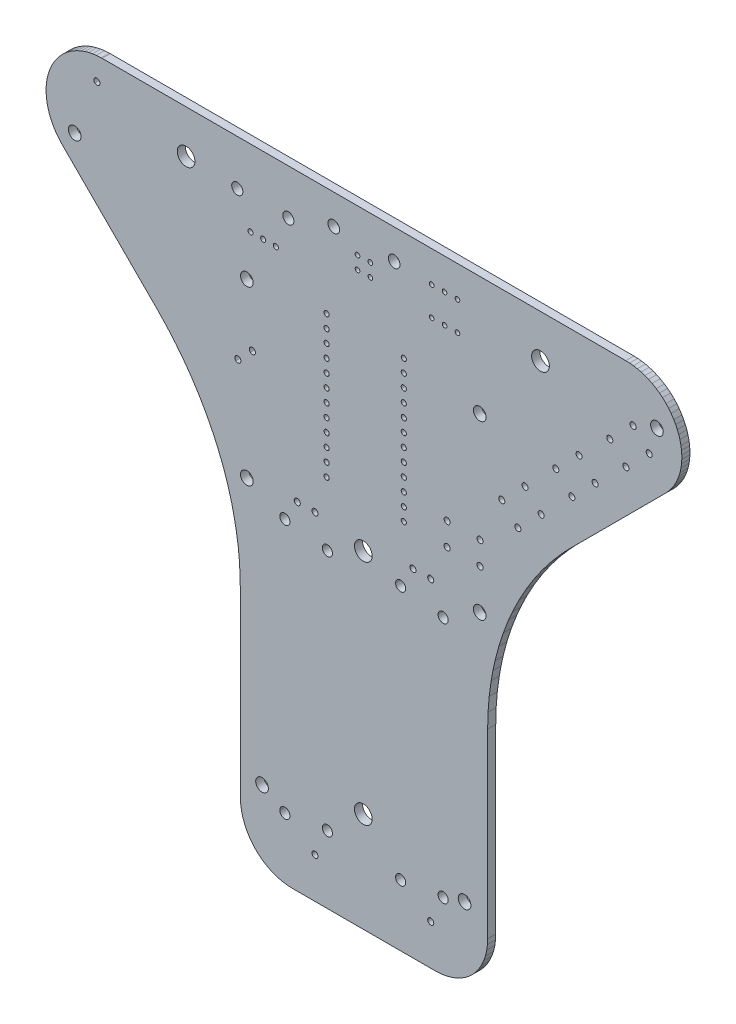
from build123d import *

# Parameters (mm, degrees)
MODEL_R             = 0.599948
MODEL_R_2           = 0.459994
MODEL_R_3           = 1.1500104
MODEL_R_4           = 1.0999978
MODEL_R_5           = 0.499999
MODEL_R_6           = 0.4572
MODEL_R_7           = 1.7500092
MODEL_R_8           = 1.2500102
BOSS_EXTRUDE1_DEPTH = 1.6


with BuildPart() as part:
    # Model → Boss-Extrude1 (new body)
    with BuildSketch(Plane.XY):
        Polygon((-24.3003324, -33.1691996), (-24.4348, -29.3327836), (-24.7142, -26.4668), (-25.1714, -23.5966), (-25.5524, -21.717), (-25.9842, -19.812), (-26.7716, -17.018), (-27.7114, -14.2748), (-28.8036, -11.557), (-29.6164, -9.779), (-30.9372, -7.1628), (-32.4104, -4.5974), (-33.9852, -2.1336), (-35.1282, -0.5334), (-36.9316, 1.8034), (-38.862, 4.064), (-40.894, 6.1976), (-40.9057094, 6.2061852), (-59.437524, 24.7379998), (-59.962161, 25.300559), (-60.4460818, 25.8980432), (-60.8868734, 26.527506), (-61.37402, 27.354657), (-61.7103414, 28.0447242), (-61.9974376, 28.756356), (-62.2338862, 29.486098), (-62.4565172, 30.4183542), (-62.5752114, 31.1758076), (-62.6404894, 31.939611), (-62.6519956, 32.7060814), (-62.6096792, 33.471485), (-62.5137434, 34.2321134), (-62.3646962, 34.9842582), (-62.1047526, 35.9069386), (-61.8391448, 36.6267492), (-61.4371898, 37.4978422), (-61.0615746, 38.1676402), (-60.6398584, 38.8098538), (-60.1740986, 39.4213588), (-59.6665558, 39.9991834), (-59.1196938, 40.5405336), (-58.5361796, 41.0427678), (-57.9188326, 41.5034476), (-57.104153, 42.0174928), (-56.4218836, 42.3768266), (-55.716043, 42.6881544), (-54.9900856, 42.9499014), (-54.2475166, 43.1608738), (-53.4919428, 43.3200048), (-52.7270472, 43.426507), (-51.7634474, 43.4849016), (-51.5703058, 43.486578), (51.8310368, 43.486578), (52.6029682, 43.4598572), (53.3711404, 43.3798726), (54.131845, 43.2469544), (54.8813736, 43.0618138), (55.616094, 42.8253144), (56.3324248, 42.5385992), (57.0268862, 42.2030652), (57.8591172, 41.7174934), (58.492263, 41.2784544), (59.0930492, 40.7966926), (59.79414, 40.1380452), (60.3117412, 39.5690852), (60.788169, 38.9657336), (61.3222802, 38.1676402), (61.6978954, 37.4978422), (62.0256062, 36.8036856), (62.3038124, 36.0885994), (62.5311678, 35.3559872), (62.7421656, 34.4210894), (62.8514364, 33.662239), (62.907164, 32.8976736), (62.9091198, 32.131127), (62.8572784, 31.3663076), (62.7518938, 30.6069238), (62.5456712, 29.6709592), (62.322075, 28.9372294), (62.047501, 28.2207462), (61.7233462, 27.524964), (61.35116, 26.8532864), (60.9327204, 26.2089646), (60.3477838, 25.4467868), (59.8330782, 24.8752106), (59.6982296, 24.7379998), (40.4734268, 5.5013352), (39.1247376, 4.0578786), (37.198046, 1.8116296), (35.391725, -0.5263388), (33.7108038, -2.9494988), (32.1599306, -5.4511194), (30.7434234, -8.024241), (29.4652446, -10.6616754), (28.6917384, -12.4521214), (27.6518116, -15.1804116), (26.758773, -17.9531518), (26.0151626, -20.7626204), (25.603454, -22.6521264), (25.2595634, -24.5521734), (24.8718578, -27.4167854), (24.6388128, -30.291786), (24.561038, -33.1691996), (24.561038, -69.0428642), (24.5178072, -70.0542414), (24.3883688, -71.0500484), (24.1207036, -72.213851), (23.8060484, -73.1490536), (23.3220768, -74.2191302), (22.8337364, -75.0594638), (22.27199, -75.846178), (21.6411302, -76.57338), (20.9459576, -77.2354818), (20.1917046, -77.8274796), (19.3841624, -78.3448776), (18.3533796, -78.8617676), (17.4506128, -79.2020514), (16.5153594, -79.4572706), (15.5547314, -79.6254948), (14.3787368, -79.7108134), (14.1810994, -79.7125914), (-13.9203684, -79.7125914), (-14.9042882, -79.6681414), (-15.8730442, -79.5350962), (-16.8193212, -79.3144718), (-17.9150518, -78.9365198), (-18.786856, -78.5300436), (-19.7735698, -77.9370552), (-20.5389226, -77.359637), (-21.2463634, -76.711175), (-22.0112844, -75.846178), (-22.5730054, -75.0594638), (-23.0613712, -74.2191302), (-23.4726226, -73.3316288), (-23.8036354, -72.4036652), (-24.0519458, -71.4423006), (-24.238077, -70.254876), (-24.2986052, -69.2460134), (-24.3003324, -69.0428642), align=None)
        with Locations((23.06193, -6.059932)):
            Circle(MODEL_R, mode=Mode.SUBTRACT)
        with Locations((16.56207, -6.059932)):
            Circle(MODEL_R, mode=Mode.SUBTRACT)
        with Locations((16.56207, -1.560068)):
            Circle(MODEL_R, mode=Mode.SUBTRACT)
        with Locations((23.06193, -1.560068)):
            Circle(MODEL_R, mode=Mode.SUBTRACT)
        with Locations((-1.143, 35.052)):
            Circle(MODEL_R_2, mode=Mode.SUBTRACT)
        with Locations((-1.143, 32.512)):
            Circle(MODEL_R_2, mode=Mode.SUBTRACT)
        with Locations((1.397, 35.052)):
            Circle(MODEL_R_2, mode=Mode.SUBTRACT)
        with Locations((6.096, 37.592)):
            Circle(MODEL_R_3, mode=Mode.SUBTRACT)
        with Locations((-5.842, 37.592)):
            Circle(MODEL_R_3, mode=Mode.SUBTRACT)
        with Locations((-14.81201, 34.544)):
            Circle(MODEL_R_4, mode=Mode.SUBTRACT)
        with Locations((-22.27072, 28.4481016)):
            Circle(MODEL_R_5, mode=Mode.SUBTRACT)
        with Locations((-19.77136, 28.4481016)):
            Circle(MODEL_R_5, mode=Mode.SUBTRACT)
        with Locations((-17.272, 28.4481016)):
            Circle(MODEL_R_5, mode=Mode.SUBTRACT)
        with Locations((-24.892, 34.544)):
            Circle(MODEL_R_4, mode=Mode.SUBTRACT)
        with Locations((16.0518094, 37.3440198)):
            Circle(MODEL_R_6, mode=Mode.SUBTRACT)
        with Locations((18.6019694, 37.3440198)):
            Circle(MODEL_R_6, mode=Mode.SUBTRACT)
        with Locations((18.6022996, 31.6440312)):
            Circle(MODEL_R_6, mode=Mode.SUBTRACT)
        with Locations((16.0521396, 31.6440312)):
            Circle(MODEL_R_6, mode=Mode.SUBTRACT)
        with Locations((13.5019796, 31.6440312)):
            Circle(MODEL_R_6, mode=Mode.SUBTRACT)
        with Locations((30.5348894, 4.239006)):
            Circle(MODEL_R, mode=Mode.SUBTRACT)
        with Locations((35.130994, 8.8351106)):
            Circle(MODEL_R, mode=Mode.SUBTRACT)
        with Locations((31.9491106, 12.016994)):
            Circle(MODEL_R, mode=Mode.SUBTRACT)
        with Locations((27.353006, 7.4208894)):
            Circle(MODEL_R, mode=Mode.SUBTRACT)
        with Locations((41.2028894, 14.907006)):
            Circle(MODEL_R, mode=Mode.SUBTRACT)
        with Locations((45.798994, 19.5031106)):
            Circle(MODEL_R, mode=Mode.SUBTRACT)
        with Locations((42.6171106, 22.684994)):
            Circle(MODEL_R, mode=Mode.SUBTRACT)
        with Locations((38.021006, 18.0888894)):
            Circle(MODEL_R, mode=Mode.SUBTRACT)
        with Locations((51.8708894, 25.321006)):
            Circle(MODEL_R, mode=Mode.SUBTRACT)
        with Locations((56.466994, 29.9171106)):
            Circle(MODEL_R, mode=Mode.SUBTRACT)
        with Locations((53.2851106, 33.098994)):
            Circle(MODEL_R, mode=Mode.SUBTRACT)
        with Locations((48.689006, 28.5028894)):
            Circle(MODEL_R, mode=Mode.SUBTRACT)
        with Locations((1.397, 32.512)):
            Circle(MODEL_R_2, mode=Mode.SUBTRACT)
        with Locations((13.5018018, 37.3438674)):
            Circle(MODEL_R_6, mode=Mode.SUBTRACT)
        with Locations((0, -60.000134)):
            Circle(MODEL_R_7, mode=Mode.SUBTRACT)
        with Locations((0, -14.99997)):
            Circle(MODEL_R_7, mode=Mode.SUBTRACT)
        with Locations((-34.99993, 34.99993)):
            Circle(MODEL_R_7, mode=Mode.SUBTRACT)
        with Locations((34.99993, 34.99993)):
            Circle(MODEL_R_7, mode=Mode.SUBTRACT)
        with Locations((19.99996, -65.000124)):
            Circle(MODEL_R_8, mode=Mode.SUBTRACT)
        with Locations((-19.99996, -65.000124)):
            Circle(MODEL_R_8, mode=Mode.SUBTRACT)
        with Locations((22.999954, -13.999972)):
            Circle(MODEL_R_8, mode=Mode.SUBTRACT)
        with Locations((-22.999954, -13.999972)):
            Circle(MODEL_R_8, mode=Mode.SUBTRACT)
        with Locations((22.999954, 19.99996)):
            Circle(MODEL_R_8, mode=Mode.SUBTRACT)
        with Locations((-22.999954, 19.99996)):
            Circle(MODEL_R_8, mode=Mode.SUBTRACT)
        with Locations((-56.999886, 27.999944)):
            Circle(MODEL_R_8, mode=Mode.SUBTRACT)
        with Locations((58.000138, 34.99993)):
            Circle(MODEL_R_8, mode=Mode.SUBTRACT)
        with BuildLine():
            Line((-7.24154, -6.477), (-7.23646, -6.477))
            ThreePointArc((-7.23646, -6.477), (-6.72846, -5.969), (-7.23646, -5.461))
            Line((-7.23646, -5.461), (-7.24154, -5.461))
            ThreePointArc((-7.24154, -5.461), (-7.74954, -5.969), (-7.24154, -6.477))
        make_face(mode=Mode.SUBTRACT)
        with BuildLine():
            Line((-7.24154, -3.937), (-7.23646, -3.937))
            ThreePointArc((-7.23646, -3.937), (-6.72846, -3.429), (-7.23646, -2.921))
            Line((-7.23646, -2.921), (-7.24154, -2.921))
            ThreePointArc((-7.24154, -2.921), (-7.74954, -3.429), (-7.24154, -3.937))
        make_face(mode=Mode.SUBTRACT)
        with BuildLine():
            Line((-7.24154, -1.397), (-7.23646, -1.397))
            ThreePointArc((-7.23646, -1.397), (-6.72846, -0.889), (-7.23646, -0.381))
            Line((-7.23646, -0.381), (-7.24154, -0.381))
            ThreePointArc((-7.24154, -0.381), (-7.74954, -0.889), (-7.24154, -1.397))
        make_face(mode=Mode.SUBTRACT)
        with BuildLine():
            Line((-7.24154, 1.143), (-7.23646, 1.143))
            ThreePointArc((-7.23646, 1.143), (-6.72846, 1.651), (-7.23646, 2.159))
            Line((-7.23646, 2.159), (-7.24154, 2.159))
            ThreePointArc((-7.24154, 2.159), (-7.74954, 1.651), (-7.24154, 1.143))
        make_face(mode=Mode.SUBTRACT)
        with BuildLine():
            Line((-7.24154, 3.683), (-7.23646, 3.683))
            ThreePointArc((-7.23646, 3.683), (-6.72846, 4.191), (-7.23646, 4.699))
            Line((-7.23646, 4.699), (-7.24154, 4.699))
            ThreePointArc((-7.24154, 4.699), (-7.74954, 4.191), (-7.24154, 3.683))
        make_face(mode=Mode.SUBTRACT)
        with BuildLine():
            Line((-7.24154, 6.223), (-7.23646, 6.223))
            ThreePointArc((-7.23646, 6.223), (-6.72846, 6.731), (-7.23646, 7.239))
            Line((-7.23646, 7.239), (-7.24154, 7.239))
            ThreePointArc((-7.24154, 7.239), (-7.74954, 6.731), (-7.24154, 6.223))
        make_face(mode=Mode.SUBTRACT)
        with BuildLine():
            Line((-7.24154, 8.763), (-7.23646, 8.763))
            ThreePointArc((-7.23646, 8.763), (-6.72846, 9.271), (-7.23646, 9.779))
            Line((-7.23646, 9.779), (-7.24154, 9.779))
            ThreePointArc((-7.24154, 9.779), (-7.74954, 9.271), (-7.24154, 8.763))
        make_face(mode=Mode.SUBTRACT)
        with BuildLine():
            Line((-7.24154, 11.303), (-7.23646, 11.303))
            ThreePointArc((-7.23646, 11.303), (-6.72846, 11.811), (-7.23646, 12.319))
            Line((-7.23646, 12.319), (-7.24154, 12.319))
            ThreePointArc((-7.24154, 12.319), (-7.74954, 11.811), (-7.24154, 11.303))
        make_face(mode=Mode.SUBTRACT)
        with BuildLine():
            Line((-7.24154, 13.843), (-7.23646, 13.843))
            ThreePointArc((-7.23646, 13.843), (-6.72846, 14.351), (-7.23646, 14.859))
            Line((-7.23646, 14.859), (-7.24154, 14.859))
            ThreePointArc((-7.24154, 14.859), (-7.74954, 14.351), (-7.24154, 13.843))
        make_face(mode=Mode.SUBTRACT)
        with BuildLine():
            Line((-7.24154, 16.383), (-7.23646, 16.383))
            ThreePointArc((-7.23646, 16.383), (-6.72846, 16.891), (-7.23646, 17.399))
            Line((-7.23646, 17.399), (-7.24154, 17.399))
            ThreePointArc((-7.24154, 17.399), (-7.74954, 16.891), (-7.24154, 16.383))
        make_face(mode=Mode.SUBTRACT)
        with BuildLine():
            Line((-7.24154, 18.923), (-7.23646, 18.923))
            ThreePointArc((-7.23646, 18.923), (-6.72846, 19.431), (-7.23646, 19.939))
            Line((-7.23646, 19.939), (-7.24154, 19.939))
            ThreePointArc((-7.24154, 19.939), (-7.74954, 19.431), (-7.24154, 18.923))
        make_face(mode=Mode.SUBTRACT)
        with BuildLine():
            Line((-7.24154, 21.463), (-7.23646, 21.463))
            ThreePointArc((-7.23646, 21.463), (-6.72846, 21.971), (-7.23646, 22.479))
            Line((-7.23646, 22.479), (-7.24154, 22.479))
            ThreePointArc((-7.24154, 22.479), (-7.74954, 21.971), (-7.24154, 21.463))
        make_face(mode=Mode.SUBTRACT)
        with BuildLine():
            Line((8.00354, 22.479), (7.99846, 22.479))
            ThreePointArc((7.99846, 22.479), (7.49046, 21.971), (7.99846, 21.463))
            Line((7.99846, 21.463), (8.00354, 21.463))
            ThreePointArc((8.00354, 21.463), (8.51154, 21.971), (8.00354, 22.479))
        make_face(mode=Mode.SUBTRACT)
        with BuildLine():
            Line((8.00354, 19.939), (7.99846, 19.939))
            ThreePointArc((7.99846, 19.939), (7.49046, 19.431), (7.99846, 18.923))
            Line((7.99846, 18.923), (8.00354, 18.923))
            ThreePointArc((8.00354, 18.923), (8.51154, 19.431), (8.00354, 19.939))
        make_face(mode=Mode.SUBTRACT)
        with BuildLine():
            Line((8.00354, 17.399), (7.99846, 17.399))
            ThreePointArc((7.99846, 17.399), (7.49046, 16.891), (7.99846, 16.383))
            Line((7.99846, 16.383), (8.00354, 16.383))
            ThreePointArc((8.00354, 16.383), (8.51154, 16.891), (8.00354, 17.399))
        make_face(mode=Mode.SUBTRACT)
        with BuildLine():
            Line((8.00354, 14.859), (7.99846, 14.859))
            ThreePointArc((7.99846, 14.859), (7.49046, 14.351), (7.99846, 13.843))
            Line((7.99846, 13.843), (8.00354, 13.843))
            ThreePointArc((8.00354, 13.843), (8.51154, 14.351), (8.00354, 14.859))
        make_face(mode=Mode.SUBTRACT)
        with BuildLine():
            Line((8.00354, 12.319), (7.99846, 12.319))
            ThreePointArc((7.99846, 12.319), (7.49046, 11.811), (7.99846, 11.303))
            Line((7.99846, 11.303), (8.00354, 11.303))
            ThreePointArc((8.00354, 11.303), (8.51154, 11.811), (8.00354, 12.319))
        make_face(mode=Mode.SUBTRACT)
        with BuildLine():
            Line((8.00354, 9.779), (7.99846, 9.779))
            ThreePointArc((7.99846, 9.779), (7.49046, 9.271), (7.99846, 8.763))
            Line((7.99846, 8.763), (8.00354, 8.763))
            ThreePointArc((8.00354, 8.763), (8.51154, 9.271), (8.00354, 9.779))
        make_face(mode=Mode.SUBTRACT)
        with BuildLine():
            Line((8.00354, 7.239), (7.99846, 7.239))
            ThreePointArc((7.99846, 7.239), (7.49046, 6.731), (7.99846, 6.223))
            Line((7.99846, 6.223), (8.00354, 6.223))
            ThreePointArc((8.00354, 6.223), (8.51154, 6.731), (8.00354, 7.239))
        make_face(mode=Mode.SUBTRACT)
        with BuildLine():
            Line((8.00354, 4.699), (7.99846, 4.699))
            ThreePointArc((7.99846, 4.699), (7.49046, 4.191), (7.99846, 3.683))
            Line((7.99846, 3.683), (8.00354, 3.683))
            ThreePointArc((8.00354, 3.683), (8.51154, 4.191), (8.00354, 4.699))
        make_face(mode=Mode.SUBTRACT)
        with BuildLine():
            Line((8.00354, 2.159), (7.99846, 2.159))
            ThreePointArc((7.99846, 2.159), (7.49046, 1.651), (7.99846, 1.143))
            Line((7.99846, 1.143), (8.00354, 1.143))
            ThreePointArc((8.00354, 1.143), (8.51154, 1.651), (8.00354, 2.159))
        make_face(mode=Mode.SUBTRACT)
        with BuildLine():
            Line((8.00354, -0.381), (7.99846, -0.381))
            ThreePointArc((7.99846, -0.381), (7.49046, -0.889), (7.99846, -1.397))
            Line((7.99846, -1.397), (8.00354, -1.397))
            ThreePointArc((8.00354, -1.397), (8.51154, -0.889), (8.00354, -0.381))
        make_face(mode=Mode.SUBTRACT)
        with BuildLine():
            Line((8.00354, -2.921), (7.99846, -2.921))
            ThreePointArc((7.99846, -2.921), (7.49046, -3.429), (7.99846, -3.937))
            Line((7.99846, -3.937), (8.00354, -3.937))
            ThreePointArc((8.00354, -3.937), (8.51154, -3.429), (8.00354, -2.921))
        make_face(mode=Mode.SUBTRACT)
        with BuildLine():
            Line((8.00354, -5.461), (7.99846, -5.461))
            ThreePointArc((7.99846, -5.461), (7.49046, -5.969), (7.99846, -6.477))
            Line((7.99846, -6.477), (8.00354, -6.477))
            ThreePointArc((8.00354, -6.477), (8.51154, -5.969), (8.00354, -5.461))
        make_face(mode=Mode.SUBTRACT)
        with BuildLine():
            Line((-10.143998, -13.124434), (-10.143998, -13.119354))
            ThreePointArc((-10.143998, -13.119354), (-9.54405, -12.519406), (-8.944102, -13.119354))
            Line((-8.944102, -13.119354), (-8.944102, -13.124434))
            ThreePointArc((-8.944102, -13.124434), (-9.54405, -13.724382), (-10.143998, -13.124434))
        make_face(mode=Mode.SUBTRACT)
        with BuildLine():
            Line((-13.644118, -13.124434), (-13.644118, -13.119354))
            ThreePointArc((-13.644118, -13.119354), (-13.04417, -12.519406), (-12.444222, -13.119354))
            Line((-12.444222, -13.119354), (-12.444222, -13.124434))
            ThreePointArc((-12.444222, -13.124434), (-13.04417, -13.724382), (-13.644118, -13.124434))
        make_face(mode=Mode.SUBTRACT)
        with BuildLine():
            Line((-10.143998, -71.716646), (-10.143998, -71.711566))
            ThreePointArc((-10.143998, -71.711566), (-9.54405, -71.111618), (-8.944102, -71.711566))
            Line((-8.944102, -71.711566), (-8.944102, -71.716646))
            ThreePointArc((-8.944102, -71.716646), (-9.54405, -72.316594), (-10.143998, -71.716646))
        make_face(mode=Mode.SUBTRACT)
        with BuildLine():
            Line((-8.094218, -66.366644), (-8.094218, -66.361564))
            ThreePointArc((-8.094218, -66.361564), (-7.09422, -65.361566), (-6.094222, -66.361564))
            Line((-6.094222, -66.361564), (-6.094222, -66.366644))
            ThreePointArc((-6.094222, -66.366644), (-7.09422, -67.366642), (-8.094218, -66.366644))
        make_face(mode=Mode.SUBTRACT)
        with BuildLine():
            Line((-8.094218, -18.474436), (-8.094218, -18.469356))
            ThreePointArc((-8.094218, -18.469356), (-7.09422, -17.469358), (-6.094222, -18.469356))
            Line((-6.094222, -18.469356), (-6.094222, -18.474436))
            ThreePointArc((-6.094222, -18.474436), (-7.09422, -19.474434), (-8.094218, -18.474436))
        make_face(mode=Mode.SUBTRACT)
        with BuildLine():
            Line((-16.493998, -17.27454), (-16.493998, -17.26946))
            ThreePointArc((-16.493998, -17.26946), (-15.494, -16.269462), (-14.494002, -17.26946))
            Line((-14.494002, -17.26946), (-14.494002, -17.27454))
            ThreePointArc((-14.494002, -17.27454), (-15.494, -18.274538), (-16.493998, -17.27454))
        make_face(mode=Mode.SUBTRACT)
        with BuildLine():
            Line((-16.493998, -67.56654), (-16.493998, -67.56146))
            ThreePointArc((-16.493998, -67.56146), (-15.494, -66.561462), (-14.494002, -67.56146))
            Line((-14.494002, -67.56146), (-14.494002, -67.56654))
            ThreePointArc((-14.494002, -67.56654), (-15.494, -68.566538), (-16.493998, -67.56654))
        make_face(mode=Mode.SUBTRACT)
        with BuildLine():
            Line((12.716002, -13.124434), (12.716002, -13.119354))
            ThreePointArc((12.716002, -13.119354), (13.31595, -12.519406), (13.915898, -13.119354))
            Line((13.915898, -13.119354), (13.915898, -13.124434))
            ThreePointArc((13.915898, -13.124434), (13.31595, -13.724382), (12.716002, -13.124434))
        make_face(mode=Mode.SUBTRACT)
        with BuildLine():
            Line((9.215882, -13.124434), (9.215882, -13.119354))
            ThreePointArc((9.215882, -13.119354), (9.81583, -12.519406), (10.415778, -13.119354))
            Line((10.415778, -13.119354), (10.415778, -13.124434))
            ThreePointArc((10.415778, -13.124434), (9.81583, -13.724382), (9.215882, -13.124434))
        make_face(mode=Mode.SUBTRACT)
        with BuildLine():
            Line((12.716002, -71.716646), (12.716002, -71.711566))
            ThreePointArc((12.716002, -71.711566), (13.31595, -71.111618), (13.915898, -71.711566))
            Line((13.915898, -71.711566), (13.915898, -71.716646))
            ThreePointArc((13.915898, -71.716646), (13.31595, -72.316594), (12.716002, -71.716646))
        make_face(mode=Mode.SUBTRACT)
        with BuildLine():
            Line((14.765782, -66.366644), (14.765782, -66.361564))
            ThreePointArc((14.765782, -66.361564), (15.76578, -65.361566), (16.765778, -66.361564))
            Line((16.765778, -66.361564), (16.765778, -66.366644))
            ThreePointArc((16.765778, -66.366644), (15.76578, -67.366642), (14.765782, -66.366644))
        make_face(mode=Mode.SUBTRACT)
        with BuildLine():
            Line((14.765782, -18.474436), (14.765782, -18.469356))
            ThreePointArc((14.765782, -18.469356), (15.76578, -17.469358), (16.765778, -18.469356))
            Line((16.765778, -18.469356), (16.765778, -18.474436))
            ThreePointArc((16.765778, -18.474436), (15.76578, -19.474434), (14.765782, -18.474436))
        make_face(mode=Mode.SUBTRACT)
        with BuildLine():
            Line((6.366002, -17.27454), (6.366002, -17.26946))
            ThreePointArc((6.366002, -17.26946), (7.366, -16.269462), (8.365998, -17.26946))
            Line((8.365998, -17.26946), (8.365998, -17.27454))
            ThreePointArc((8.365998, -17.27454), (7.366, -18.274538), (6.366002, -17.27454))
        make_face(mode=Mode.SUBTRACT)
        with BuildLine():
            Line((6.366002, -67.56654), (6.366002, -67.56146))
            ThreePointArc((6.366002, -67.56146), (7.366, -66.561462), (8.365998, -67.56146))
            Line((8.365998, -67.56146), (8.365998, -67.56654))
            ThreePointArc((8.365998, -67.56654), (7.366, -68.566538), (6.366002, -67.56654))
        make_face(mode=Mode.SUBTRACT)
        with BuildLine():
            Line((-22.330736699, 7.845961901), (-22.327155299, 7.842380501))
            ThreePointArc((-22.327155299, 7.842380501), (-21.478700701, 7.842380501), (-21.478700701, 8.690835099))
            Line((-21.478700701, 8.690835099), (-21.482282101, 8.694416499))
            ThreePointArc((-21.482282101, 8.694416499), (-22.330736699, 8.694416499), (-22.330736699, 7.845961901))
        make_face(mode=Mode.SUBTRACT)
        with BuildLine():
            Line((-25.204416499, 4.972282101), (-25.200835099, 4.968700701))
            ThreePointArc((-25.200835099, 4.968700701), (-24.352380501, 4.968700701), (-24.352380501, 5.817155299))
            Line((-24.352380501, 5.817155299), (-24.355961901, 5.820736699))
            ThreePointArc((-24.355961901, 5.820736699), (-25.204416499, 5.820736699), (-25.204416499, 4.972282101))
        make_face(mode=Mode.SUBTRACT)
        with BuildLine():
            Line((-53.043222899, 38.558448101), (-53.039641499, 38.554866701))
            ThreePointArc((-53.039641499, 38.554866701), (-52.191186901, 38.554866701), (-52.191186901, 39.403321299))
            Line((-52.191186901, 39.403321299), (-52.194768301, 39.406902699))
            ThreePointArc((-52.194768301, 39.406902699), (-53.043222899, 39.406902699), (-53.043222899, 38.558448101))
        make_face(mode=Mode.SUBTRACT)
    extrude(amount=BOSS_EXTRUDE1_DEPTH)


solid = part.part
